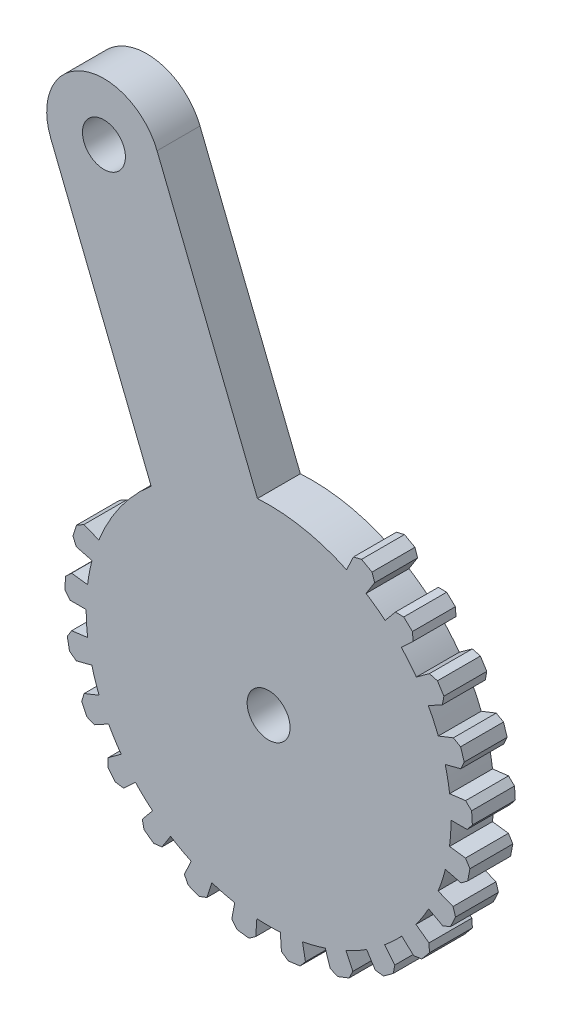
from build123d import *

# Parameters (mm, degrees)
SKETCH1_R           = 1.5
BOSS_EXTRUDE2_DEPTH = 3


with BuildPart() as part:
    # Sketch1 → Boss-Extrude2 (new body)
    with BuildSketch(Plane.XY):
        with BuildLine():
            Line((-15.222508379, 27.299729644), (-8.208462227, 9.756210733))
            ThreePointArc((-8.208462227, 9.756210733), (-9.850646229, 8.094891529), (-11.162172719, 6.161850387))
            ThreePointArc((-11.162172719, 6.161850387), (-11.536544919, 5.428685967), (-11.862823992, 4.672890641))
            Line((-11.862823992, 4.672890641), (-12.909543756, 5.085204521))
            Line((-12.909543756, 5.085204521), (-13.417390562, 4.799596912))
            Line((-13.417390562, 4.799596912), (-13.676029266, 4.003588828))
            Line((-13.676029266, 4.003588828), (-13.43304851, 3.474022556))
            Line((-13.43304851, 3.474022556), (-12.343882415, 3.192345052))
            ThreePointArc((-12.343882415, 3.192345052), (-12.524162447, 2.389111761), (-12.652232208, 1.575918828))
            Line((-12.652232208, 1.575918828), (-13.768605638, 1.71497049))
            Line((-13.768605638, 1.71497049), (-14.189469779, 1.312039404))
            Line((-14.189469779, 1.312039404), (-14.242023712, 0.476718548))
            Line((-14.242023712, 0.476718548), (-13.874978867, 0.024216431))
            Line((-13.874978867, 0.024216431), (-12.749980581, 0.022252937))
            ThreePointArc((-12.749980581, 0.022252937), (-12.724840787, -0.800579124), (-12.646654143, -1.62007376))
            Line((-12.646654143, -1.62007376), (-13.762535391, -1.763021444))
            Line((-13.762535391, -1.763021444), (-14.069972424, -2.257958364))
            Line((-14.069972424, -2.257958364), (-13.91313943, -3.080105712))
            Line((-13.91313943, -3.080105712), (-13.445093273, -3.427111302))
            Line((-13.445093273, -3.427111302), (-12.354950575, -3.149237412))
            ThreePointArc((-12.354950575, -3.149237412), (-12.125970583, -3.939966678), (-11.846440287, -4.714271155))
            Line((-11.846440287, -4.714271155), (-12.89171443, -5.130236257))
            Line((-12.89171443, -5.130236257), (-13.066406957, -5.686080305))
            Line((-13.066406957, -5.686080305), (-12.710041429, -6.443395602))
            Line((-12.710041429, -6.443395602), (-12.170403021, -6.663101027))
            Line((-12.170403021, -6.663101027), (-11.183613587, -6.122849592))
            ThreePointArc((-11.183613587, -6.122849592), (-10.76518105, -6.831791636), (-10.30187102, -7.512253556))
            Line((-10.30187102, -7.512253556), (-11.210859639, -8.175099458))
            Line((-11.210859639, -8.175099458), (-11.241831085, -8.756924908))
            Line((-11.241831085, -8.756924908), (-10.70832478, -9.401823249))
            Line((-10.70832478, -9.401823249), (-10.131001588, -9.48042361))
            Line((-10.131001588, -9.48042361), (-9.309569027, -8.711740614))
            ThreePointArc((-9.309569027, -8.711740614), (-8.727975601, -9.29435), (-8.109997309, -9.838213438))
            Line((-8.109997309, -9.838213438), (-8.825585306, -10.706291095))
            Line((-8.825585306, -10.706291095), (-8.710889622, -11.277539713))
            Line((-8.710889622, -11.277539713), (-8.033764703, -11.769499764))
            Line((-8.033764703, -11.769499764), (-7.455032066, -11.702056311))
            Line((-7.455032066, -11.702056311), (-6.850570006, -10.753240934))
            ThreePointArc((-6.850570006, -10.753240934), (-6.142359345, -11.172910171), (-5.40854264, -11.546002187))
            Line((-5.40854264, -11.546002187), (-5.885766991, -12.564767086))
            Line((-5.885766991, -12.564767086), (-5.632610928, -13.089545223))
            Line((-5.632610928, -13.089545223), (-4.854413643, -13.397655324))
            Line((-4.854413643, -13.397655324), (-4.310635461, -13.188405776))
            Line((-4.310635461, -13.188405776), (-3.961124478, -12.119075578))
            ThreePointArc((-3.961124478, -12.119075578), (-3.170796061, -12.349435304), (-2.367249346, -12.528313156))
            Line((-2.367249346, -12.528313156), (-2.576124288, -13.633752552))
            Line((-2.576124288, -13.633752552), (-2.200414573, -14.079086466))
            Line((-2.200414573, -14.079086466), (-1.370041921, -14.183986927))
            Line((-1.370041921, -14.183986927), (-0.895385777, -13.846079204))
            Line((-0.895385777, -13.846079204), (-0.82278693, -12.723424133))
            ThreePointArc((-0.82278693, -12.723424133), (0, -12.75), (0.82278693, -12.723424133))
            Line((0.82278693, -12.723424133), (0.895385777, -13.846079204))
            Line((0.895385777, -13.846079204), (1.370041921, -14.183986927))
            Line((1.370041921, -14.183986927), (2.200414573, -14.079086466))
            Line((2.200414573, -14.079086466), (2.576124288, -13.633752552))
            Line((2.576124288, -13.633752552), (2.367249346, -12.528313156))
            ThreePointArc((2.367249346, -12.528313156), (3.170796061, -12.349435304), (3.961124478, -12.119075578))
            Line((3.961124478, -12.119075578), (4.310635461, -13.188405776))
            Line((4.310635461, -13.188405776), (4.854413643, -13.397655324))
            Line((4.854413643, -13.397655324), (5.632610928, -13.089545223))
            Line((5.632610928, -13.089545223), (5.885766991, -12.564767086))
            Line((5.885766991, -12.564767086), (5.40854264, -11.546002187))
            ThreePointArc((5.40854264, -11.546002187), (6.142359345, -11.172910171), (6.850570006, -10.753240934))
            Line((6.850570006, -10.753240934), (7.455032066, -11.702056311))
            Line((7.455032066, -11.702056311), (8.033764703, -11.769499764))
            Line((8.033764703, -11.769499764), (8.710889622, -11.277539713))
            Line((8.710889622, -11.277539713), (8.825585306, -10.706291095))
            Line((8.825585306, -10.706291095), (8.109997309, -9.838213438))
            ThreePointArc((8.109997309, -9.838213438), (8.727975601, -9.29435), (9.309569027, -8.711740614))
            Line((9.309569027, -8.711740614), (10.131001588, -9.48042361))
            Line((10.131001588, -9.48042361), (10.70832478, -9.401823249))
            Line((10.70832478, -9.401823249), (11.241831085, -8.756924908))
            Line((11.241831085, -8.756924908), (11.210859639, -8.175099458))
            Line((11.210859639, -8.175099458), (10.30187102, -7.512253556))
            ThreePointArc((10.30187102, -7.512253556), (10.76518105, -6.831791636), (11.183613587, -6.122849592))
            Line((11.183613587, -6.122849592), (12.170403021, -6.663101027))
            Line((12.170403021, -6.663101027), (12.710041429, -6.443395602))
            Line((12.710041429, -6.443395602), (13.066406957, -5.686080305))
            Line((13.066406957, -5.686080305), (12.89171443, -5.130236257))
            Line((12.89171443, -5.130236257), (11.846440287, -4.714271155))
            ThreePointArc((11.846440287, -4.714271155), (12.125970583, -3.939966678), (12.354950575, -3.149237412))
            Line((12.354950575, -3.149237412), (13.445093273, -3.427111302))
            Line((13.445093273, -3.427111302), (13.91313943, -3.080105712))
            Line((13.91313943, -3.080105712), (14.069972424, -2.257958364))
            Line((14.069972424, -2.257958364), (13.762535391, -1.763021444))
            Line((13.762535391, -1.763021444), (12.646654143, -1.62007376))
            ThreePointArc((12.646654143, -1.62007376), (12.724840787, -0.800579124), (12.749980581, 0.022252937))
            Line((12.749980581, 0.022252937), (13.874978867, 0.024216431))
            Line((13.874978867, 0.024216431), (14.242023712, 0.476718548))
            Line((14.242023712, 0.476718548), (14.189469779, 1.312039404))
            Line((14.189469779, 1.312039404), (13.768605638, 1.71497049))
            Line((13.768605638, 1.71497049), (12.652232208, 1.575918828))
            ThreePointArc((12.652232208, 1.575918828), (12.524162447, 2.389111761), (12.343882415, 3.192345052))
            Line((12.343882415, 3.192345052), (13.43304851, 3.474022556))
            Line((13.43304851, 3.474022556), (13.676029266, 4.003588828))
            Line((13.676029266, 4.003588828), (13.417390562, 4.799596912))
            Line((13.417390562, 4.799596912), (12.909543756, 5.085204521))
            Line((12.909543756, 5.085204521), (11.862823992, 4.672890641))
            ThreePointArc((11.862823992, 4.672890641), (11.536544919, 5.428685967), (11.162172719, 6.161850387))
            Line((11.162172719, 6.161850387), (12.147070312, 6.705543068))
            Line((12.147070312, 6.705543068), (12.250719604, 7.278898898))
            Line((12.250719604, 7.278898898), (11.80224735, 7.985578094))
            Line((11.80224735, 7.985578094), (11.239327761, 8.13591645))
            Line((11.239327761, 8.13591645), (10.328030916, 7.476247548))
            ThreePointArc((10.328030916, 7.476247548), (9.824043845, 8.127155869), (9.27910266, 8.744184))
            Line((9.27910266, 8.744184), (10.097847012, 9.515729647))
            Line((10.097847012, 9.515729647), (10.055652175, 10.096848981))
            Line((10.055652175, 10.096848981), (9.445525531, 10.669796035))
            Line((9.445525531, 10.669796035), (8.862903468, 10.675418826))
            Line((8.862903468, 10.675418826), (8.144289673, 9.809844327))
            ThreePointArc((8.144289673, 9.809844327), (7.494261967, 10.314966678), (6.812992455, 10.777088374))
            Line((6.812992455, 10.777088374), (7.414138848, 11.728007936))
            Line((7.414138848, 11.728007936), (7.228751137, 12.280376908))
            Line((7.228751137, 12.280376908), (6.495306606, 12.683591451))
            Line((6.495306606, 12.683591451), (5.929590354, 12.544145377))
            Line((5.929590354, 12.544145377), (5.448812758, 11.527052508))
            ThreePointArc((5.448812758, 11.527052508), (4.733275563, 11.838859846), (4, 12.106300013))
            ThreePointArc((4, 12.106300013), (1.639477491, 12.644153335), (-0.78015801, 12.726109126))
            Line((-0.78015801, 12.726109126), (-7.794204162, 30.269628037))
            ThreePointArc((-7.794204162, 30.269628037), (-12.993305466, 32.498830949), (-15.222508379, 27.299729644))
        make_face()
        Circle(SKETCH1_R, mode=Mode.SUBTRACT)
        with Locations((-11.50835627, 28.784678841)):
            Circle(SKETCH1_R, mode=Mode.SUBTRACT)
    extrude(amount=BOSS_EXTRUDE2_DEPTH)


solid = part.part
